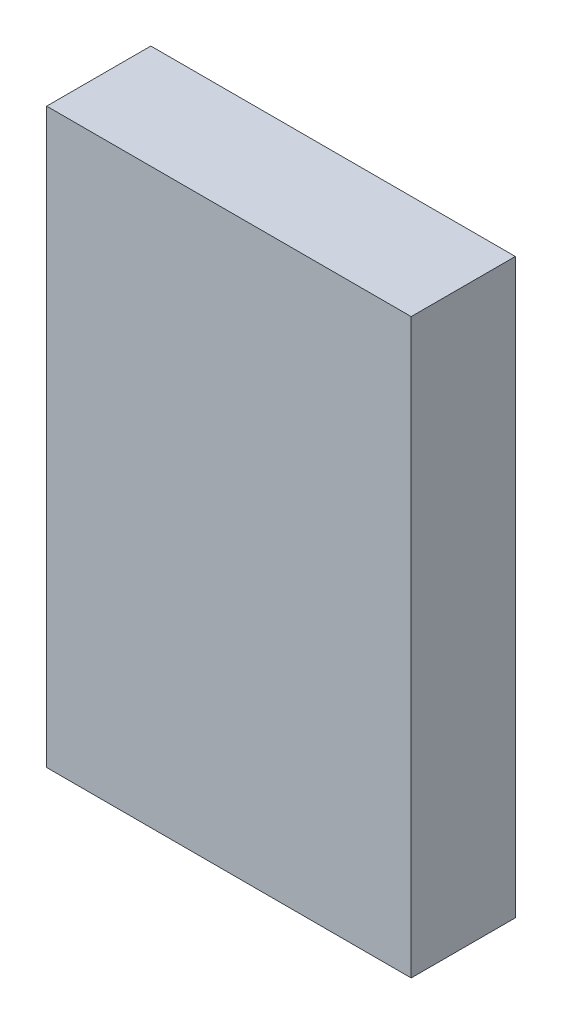
from build123d import *

# Parameters (mm, degrees)
SKETCH1_W           = 44.45
SKETCH1_H           = 69.85
BOSS_EXTRUDE1_DEPTH = 6.35


with BuildPart() as part:
    # Sketch1 → Boss-Extrude1 (new, symmetric)
    with BuildSketch(Plane.XY):
        Rectangle(SKETCH1_W, SKETCH1_H)
    extrude(amount=BOSS_EXTRUDE1_DEPTH, both=True)


solid = part.part
